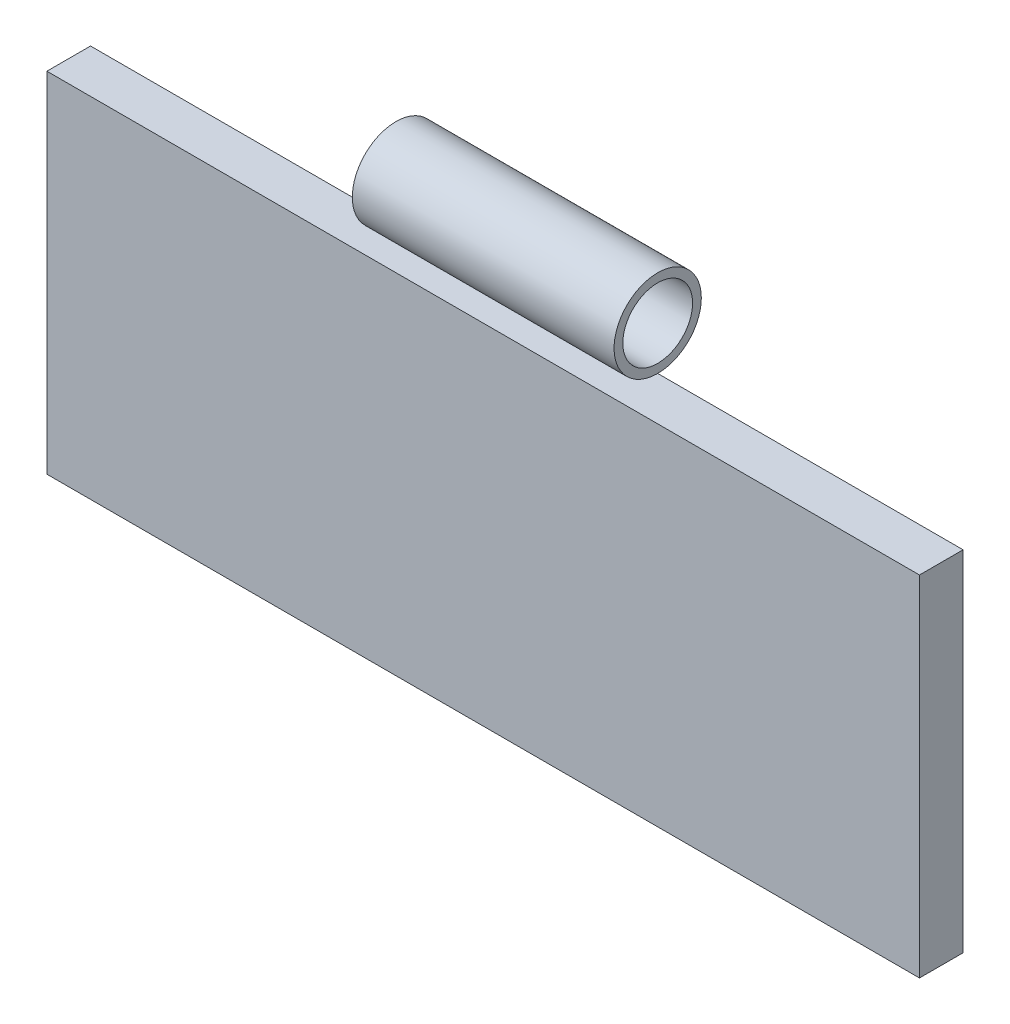
from build123d import *

# Parameters (mm, degrees)
SKETCH1_W           = 100
SKETCH1_H           = 40
BOSS_EXTRUDE1_DEPTH = 5
SKETCH2_W           = 30
SKETCH2_H           = 5
SKETCH3_R           = 4
CUT_EXTRUDE1_DEPTH  = 30


with BuildPart() as part:
    # Sketch1 → Boss-Extrude1 (new body)
    with BuildSketch(Plane.XY):
        Rectangle(SKETCH1_W, SKETCH1_H)
    extrude(amount=BOSS_EXTRUDE1_DEPTH)


with BuildPart() as body_2:
    # Sketch2 → Revolve-Thin1 (revolve)
    with BuildSketch(Plane(origin=(0, 0, 0), x_dir=(-1, 0, 0), z_dir=(0, 0, -1)), mode=Mode.PRIVATE) as revolve_thin1_sk:
        with Locations((0, 27.5)):
            Rectangle(SKETCH2_W, SKETCH2_H)
    revolve(revolve_thin1_sk.sketch.rotate(Axis((15, 25, 0), (-1, 0, 0)), 90), axis=Axis((15, 25, 0), (-1, 0, 0)))

    # Sketch3 → Cut-Extrude1 (cut)
    with BuildSketch(Plane.ZY.offset(15)):
        with Locations((0, 25)):
            Circle(SKETCH3_R)
    extrude(amount=-CUT_EXTRUDE1_DEPTH, mode=Mode.SUBTRACT)


solid = Compound([part.part, body_2.part])
